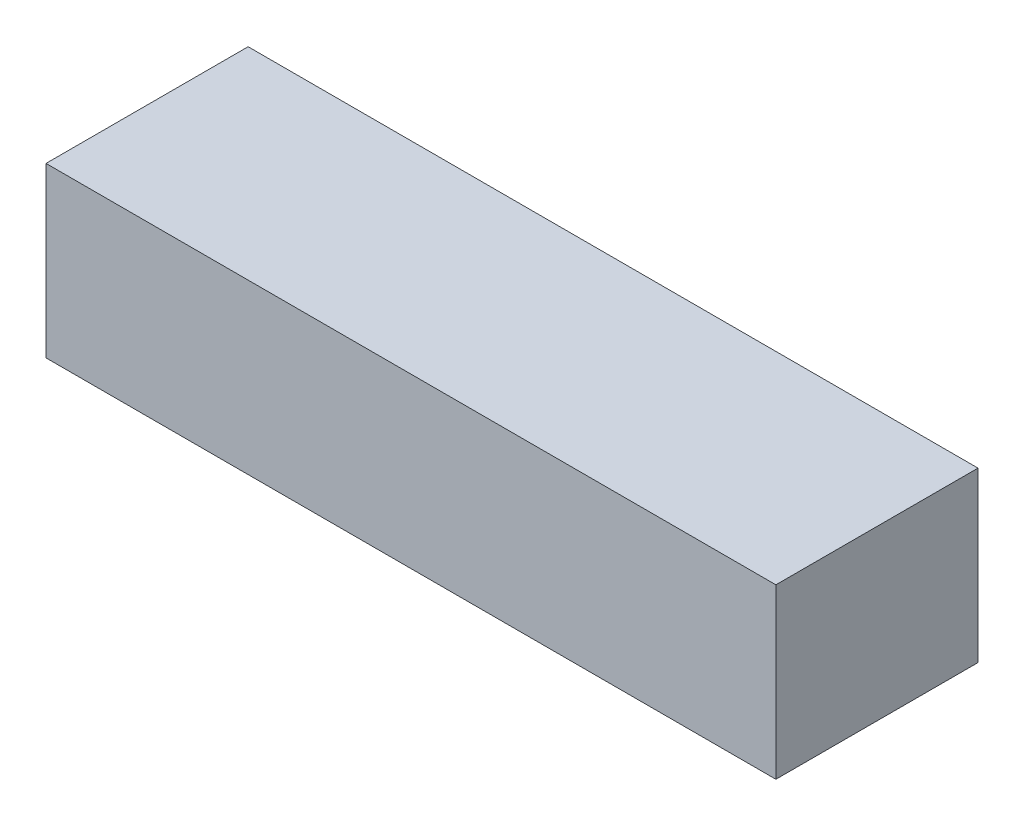
from build123d import *

# Parameters (mm, degrees)
CROQUIS1_W              = 65
CROQUIS1_H              = 15
SALIENTE_EXTRUIR1_DEPTH = 18


with BuildPart() as part:
    # Croquis1 → Saliente-Extruir1 (new body)
    with BuildSketch(Plane.XY):
        with Locations((32.5, 7.5)):
            Rectangle(CROQUIS1_W, CROQUIS1_H)
    extrude(amount=-SALIENTE_EXTRUIR1_DEPTH)


solid = part.part
